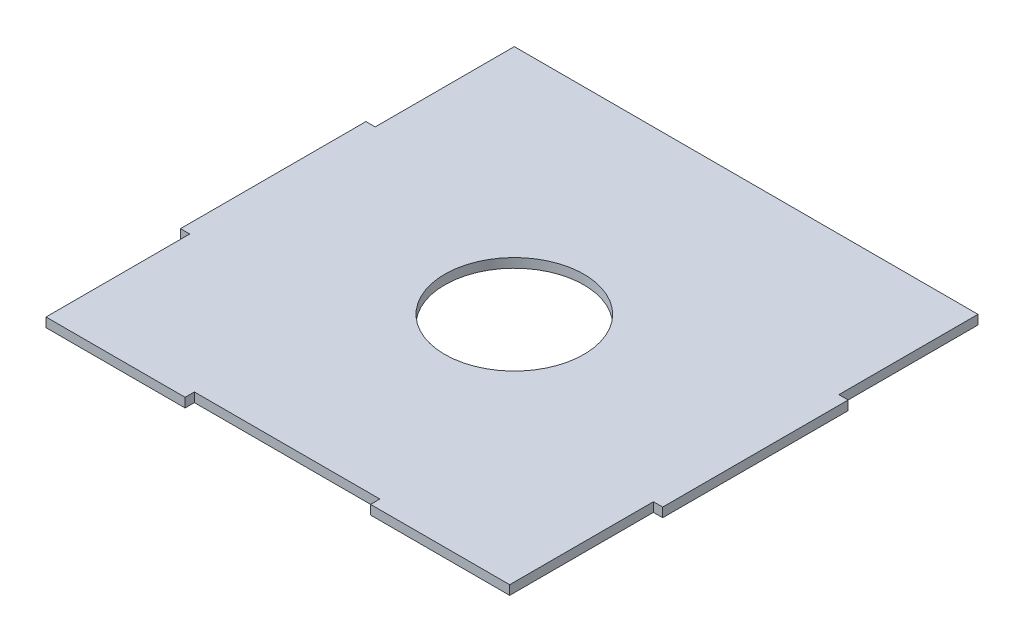
from build123d import *

# Parameters (mm, degrees)
SKETCH_1_R      = 15
EXTRUDE_1_DEPTH = 2


with BuildPart() as part:
    # 草图1 → 凸台-拉伸1 (new body)
    with BuildSketch(Plane(origin=(0, 0, 0), x_dir=(1, 0, 0), z_dir=(0, 1, 0))):
        Polygon((0, -1), (30, -1), (30, 1), (70, 1), (70, -1), (100, -1), (100, 30), (102, 30), (102, 70), (100, 70), (100, 100), (0, 100), (0, 70), (-2, 70), (-2, 30), (0, 30), align=None)
        with Locations(Location((50, 50, 0), (0, 0, 270))):
            Circle(SKETCH_1_R, mode=Mode.SUBTRACT)
    extrude(amount=EXTRUDE_1_DEPTH)


solid = part.part
